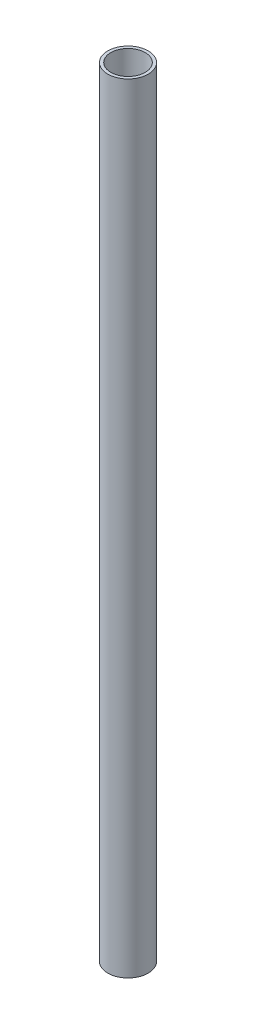
from build123d import *

# Parameters (mm, degrees)
SKETCH1_W = 1.651
SKETCH1_H = 428.498


with BuildPart() as part:
    # Sketch1 → Revolve1 (revolve)
    with BuildSketch(Plane.XY):
        with Locations((10.287, 0)):
            Rectangle(SKETCH1_W, SKETCH1_H)
    revolve(axis=Axis((0, -69.190661529, 0), (0, 1, 0)))


solid = part.part
